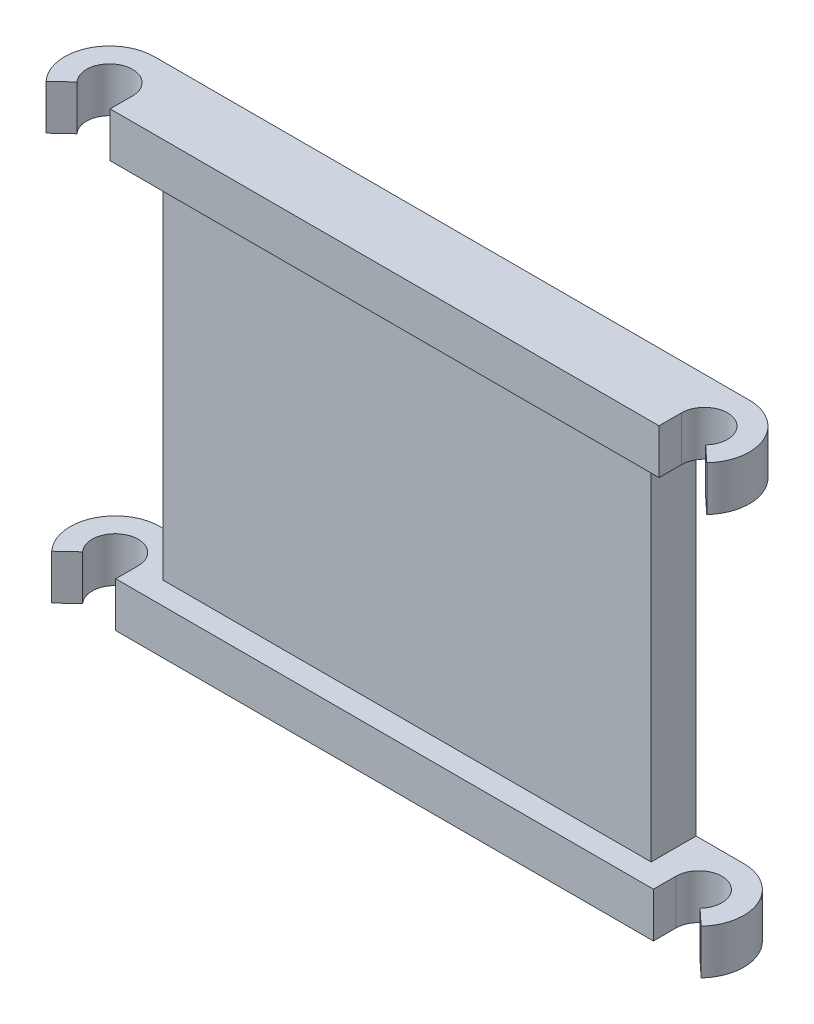
from build123d import *

# Parameters (mm, degrees)
MID_CLIP_DEPTH              = 4
REAR_CLIP_DEPTH             = 4
SZKIC4_W                    = 43.5
SZKIC4_H                    = 64
DODANIE_WYCI_GNI_CIE3_DEPTH = 8


with BuildPart() as part:
    # Szkic2 → Mid Clip (new, symmetric)
    with BuildSketch(Plane(origin=(0, -36, 0), x_dir=(1, 0, 0), z_dir=(0, 1, 0))):
        with BuildLine():
            Line((52, 8), (0, 8))
            Line((0, 8), (0, -4))
            Line((0, -4), (47.9, -4))
            Line((47.9, -4), (47.9, 0))
            ThreePointArc((47.9, 0), (53.501665742, 3.815101571), (55, -2.794637722))
            Line((55, -2.794637722), (57.853658537, -5.452951654))
            ThreePointArc((57.853658537, -5.452951654), (59.335653114, 3.191894952), (52, 8))
        make_face()
    mid_clip = extrude(amount=MID_CLIP_DEPTH, both=True)



with BuildPart() as body_2:
    # Szkic3 → Rear Clip (new, symmetric)
    with BuildSketch(Plane(origin=(0, 36, 0), x_dir=(1, 0, 0), z_dir=(0, 1, 0))):
        with BuildLine():
            Line((53, 8), (0, 8))
            Line((0, 8), (0, -4))
            Line((0, -4), (48.9, -4))
            Line((48.9, -4), (48.9, 0))
            ThreePointArc((48.9, 0), (54.501665742, 3.815101571), (56, -2.794637722))
            Line((56, -2.794637722), (58.853658537, -5.452951654))
            ThreePointArc((58.853658537, -5.452951654), (60.335653114, 3.191894952), (53, 8))
        make_face()
    rear_clip = extrude(amount=REAR_CLIP_DEPTH, both=True)


with BuildPart() as part_1:
    add(part.part)

    add(body_2.part)  # Dodanie-wyciągnięcie3 merges body 2
    # Szkic4 → Dodanie-wyciągnięcie3 (add)
    with BuildSketch(Plane(origin=(0, 0, -8), x_dir=(-1, 0, 0), z_dir=(0, 0, -1))):
        with Locations((-21.75, 0)):
            Rectangle(SZKIC4_W, SZKIC4_H)
    dodanie_wyci_gni_cie3 = extrude(amount=-DODANIE_WYCI_GNI_CIE3_DEPTH)

    # Lustro2: Mid Clip, Rear Clip, Dodanie-wyciągnięcie3 across plane
    add(mid_clip.mirror(Plane(origin=(0, -40, -8), x_dir=(0, 0, 1), z_dir=(-1, 0, 0))))
    add(rear_clip.mirror(Plane(origin=(0, -40, -8), x_dir=(0, 0, 1), z_dir=(-1, 0, 0))))
    add(dodanie_wyci_gni_cie3.mirror(Plane(origin=(0, -40, -8), x_dir=(0, 0, 1), z_dir=(-1, 0, 0))))


solid = part_1.part
